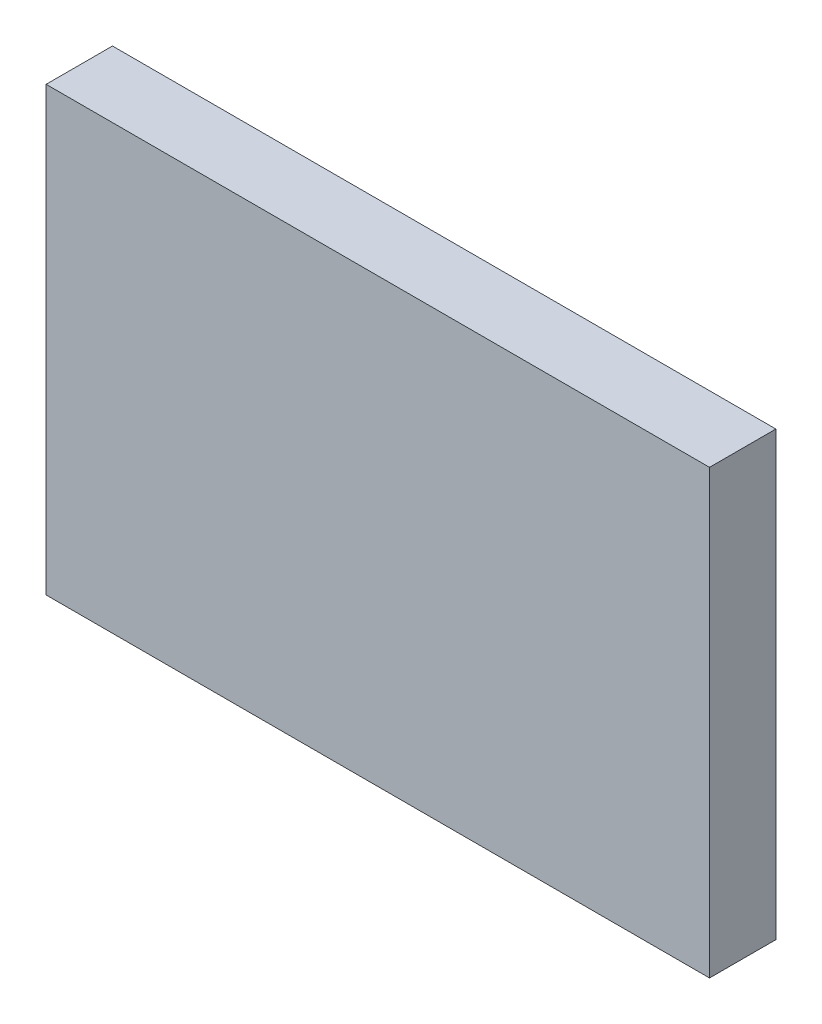
from build123d import *

# Parameters (mm, degrees)
SKIZZE1_W                       = 30
SKIZZE1_H                       = 20
AUFSATZ_LINEAR_AUSTRAGEN1_DEPTH = 3


with BuildPart() as part:
    # Skizze1 → Aufsatz-Linear austragen1 (new body)
    with BuildSketch(Plane.XY):
        Rectangle(SKIZZE1_W, SKIZZE1_H)
    extrude(amount=AUFSATZ_LINEAR_AUSTRAGEN1_DEPTH)


solid = part.part
